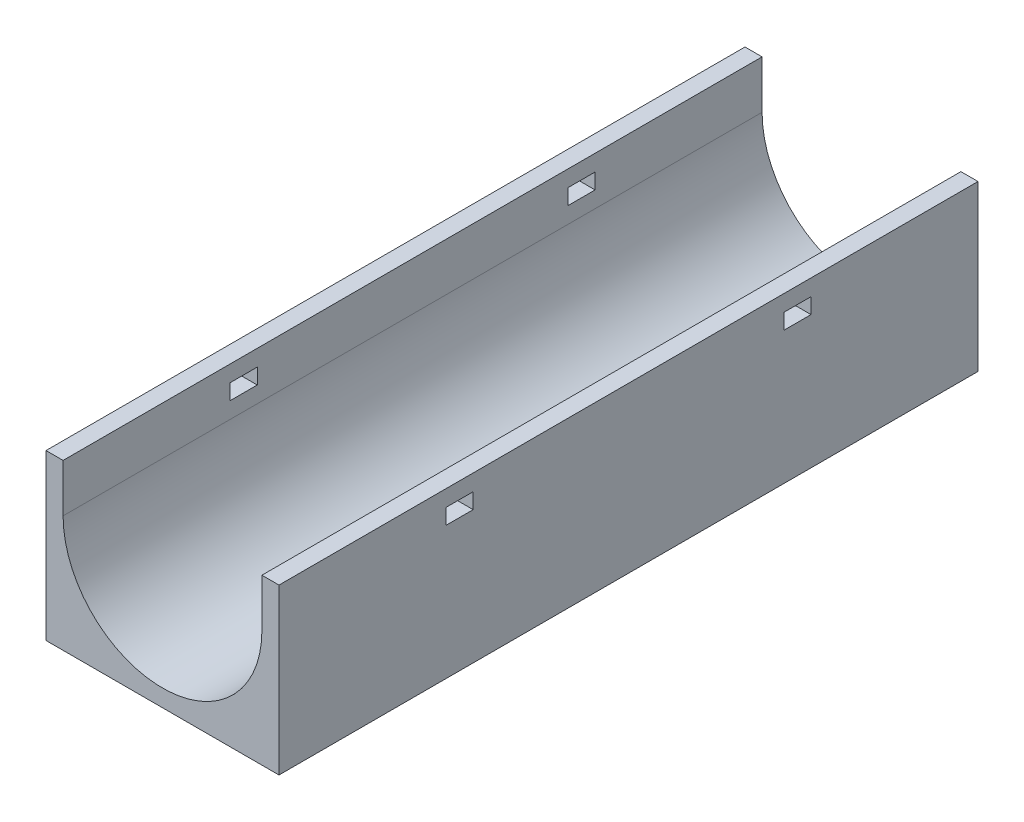
from build123d import *

# Parameters (mm, degrees)
SKETCH1_W           = 76.2
SKETCH1_H           = 228.6
BOSS_EXTRUDE1_DEPTH = 38.1
SKETCH2_R           = 32.512
CUT_EXTRUDE2_DEPTH  = 244.959033446
SKETCH3_W           = 5.588
SKETCH3_H           = 15.705533419
BOSS_EXTRUDE2_DEPTH = 228.6
SKETCH4_W           = 8.89
SKETCH4_H           = 5.08
CUT_EXTRUDE3_DEPTH  = 247.899646469


with BuildPart() as part:
    # Sketch1 → Boss-Extrude1 (new body)
    with BuildSketch(Plane(origin=(0, 0, 0), x_dir=(1, 0, 0), z_dir=(0, 1, 0))):
        with Locations((38.1, 114.3)):
            Rectangle(SKETCH1_W, SKETCH1_H)
    extrude(amount=BOSS_EXTRUDE1_DEPTH)

    # Sketch2 → Cut-Extrude2 (cut, through all)
    with BuildSketch(Plane.XY):
        with Locations((38.1, 38.1)):
            Circle(SKETCH2_R)
    extrude(amount=-CUT_EXTRUDE2_DEPTH, mode=Mode.SUBTRACT)

    # Sketch3 → Boss-Extrude2 (add)
    with BuildSketch(Plane.XY):
        with Locations((2.794, 45.95276671)):
            Rectangle(SKETCH3_W, SKETCH3_H)
        with Locations((73.406, 45.95276671)):
            Rectangle(SKETCH3_W, SKETCH3_H)
    extrude(amount=-BOSS_EXTRUDE2_DEPTH)

    # Sketch4 → Cut-Extrude3 (cut, through all)
    with BuildSketch(Plane(origin=(76.2, 0, 0), x_dir=(0, 0, -1), z_dir=(1, 0, 0))):
        with Locations((59.055, 45.95276671)):
            Rectangle(SKETCH4_W, SKETCH4_H)
        with Locations((169.545, 45.95276671)):
            Rectangle(SKETCH4_W, SKETCH4_H)
    extrude(amount=-CUT_EXTRUDE3_DEPTH, mode=Mode.SUBTRACT)


solid = part.part
